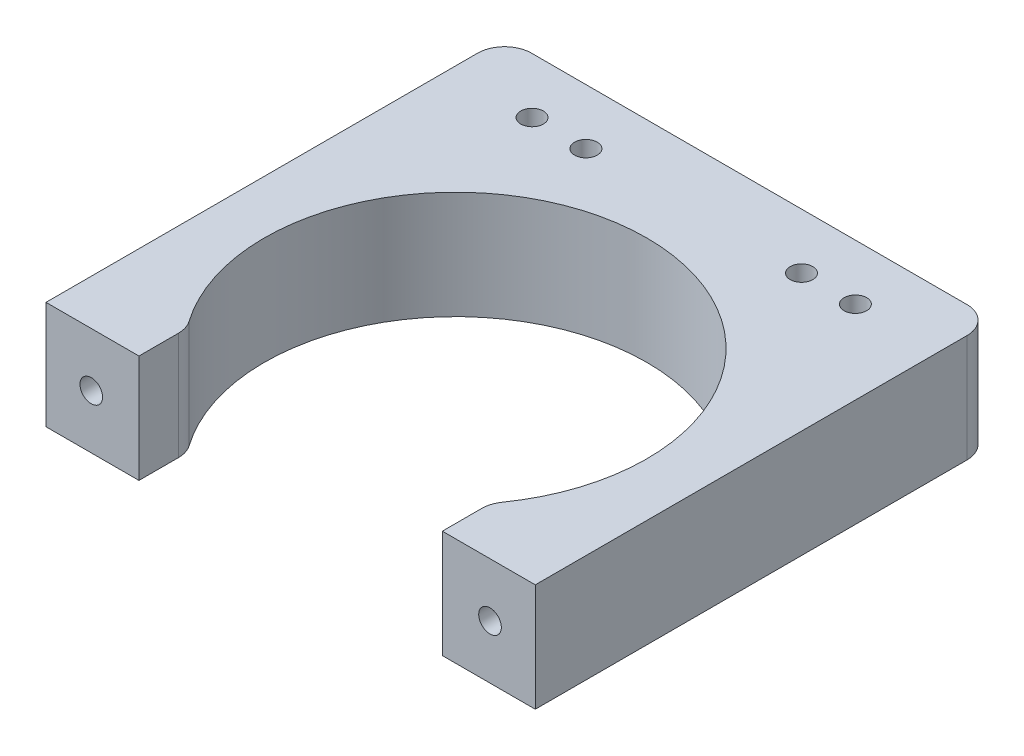
from build123d import *

# Parameters (mm, degrees)
BOSS_EXTRUDE1_DEPTH            = 20
SKETCH3_R                      = 2.1
CUT_EXTRUDE1_DEPTH             = 66.357956669
F_4_2_4_2_DIAMETER_HOLE1_D     = 4.2
F_4_2_4_2_DIAMETER_HOLE1_DEPTH = 6
F_4_2_4_2_DIAMETER_HOLE1_TIP   = 1.2618073
F_4_2_4_2_DIAMETER_HOLE4_D     = 4.2
F_4_2_4_2_DIAMETER_HOLE4_DEPTH = 6
F_4_2_4_2_DIAMETER_HOLE4_TIP   = 1.2618073
FILLET2_R                      = 5


with BuildPart() as part:
    # Sketch1 → Boss-Extrude1 (new body)
    with BuildSketch(Plane(origin=(0, 0, 0), x_dir=(1, 0, 0), z_dir=(0, 1, 0))):
        with BuildLine():
            Line((28.15, -42.55), (45.4, -42.55))
            Line((45.4, -42.55), (45.4, 42.55))
            Line((45.4, 42.55), (-45.4, 42.55))
            Line((-45.4, 42.55), (-45.4, -42.55))
            Line((-45.4, -42.55), (-28.15, -42.55))
            Line((-28.15, -42.55), (-28.15, -33.579320378))
            ThreePointArc((-28.15, -33.579320378), (0, 23.55), (28.15, -33.579320378))
            Line((28.15, -33.579320378), (28.15, -42.55))
        make_face()
    extrude(amount=BOSS_EXTRUDE1_DEPTH)

    # Sketch3 → Cut-Extrude1 (cut, through all)
    with BuildSketch(Plane(origin=(0, 20, 0), x_dir=(1, 0, 0), z_dir=(0, 1, 0))):
        with Locations(Location((-30, 32.25, 0), (0, 0, 270))):
            Circle(SKETCH3_R)
        with Locations(Location((-20, 32.25, 0), (0, 0, 270))):
            Circle(SKETCH3_R)
        with Locations(Location((20, 32.25, 0), (0, 0, 90))):
            Circle(SKETCH3_R)
        with Locations(Location((30, 32.25, 0), (0, 0, 90))):
            Circle(SKETCH3_R)
    extrude(amount=-CUT_EXTRUDE1_DEPTH, mode=Mode.SUBTRACT)

    # Ø4.2 (4.2) Diameter Hole1
    with Locations(Plane(origin=(0, 0, -42.55), x_dir=(-1, 0, 0), z_dir=(0, 0, -1))):
        with Locations((-30, 10), (-10, 10), (10, 10), (30, 10)):
            Hole(F_4_2_4_2_DIAMETER_HOLE1_D / 2, depth=F_4_2_4_2_DIAMETER_HOLE1_DEPTH)
            with Locations((0, 0, -(F_4_2_4_2_DIAMETER_HOLE1_DEPTH + F_4_2_4_2_DIAMETER_HOLE1_TIP / 2))):  # 118° drill point
                Cone(0, F_4_2_4_2_DIAMETER_HOLE1_D / 2, F_4_2_4_2_DIAMETER_HOLE1_TIP, mode=Mode.SUBTRACT)

    # Ø4.2 (4.2) Diameter Hole4
    with Locations(Plane.ZY.offset(45.4)):
        with Locations((-17.45, 10), (22.55, 10)):
            Hole(F_4_2_4_2_DIAMETER_HOLE4_D / 2, depth=F_4_2_4_2_DIAMETER_HOLE4_DEPTH)
            with Locations((0, 0, -(F_4_2_4_2_DIAMETER_HOLE4_DEPTH + F_4_2_4_2_DIAMETER_HOLE4_TIP / 2))):  # 118° drill point
                Cone(0, F_4_2_4_2_DIAMETER_HOLE4_D / 2, F_4_2_4_2_DIAMETER_HOLE4_TIP, mode=Mode.SUBTRACT)

    # Sketch20 → Ø4.2 (4.2) Diameter Hole6 (revolve, cut)
    with BuildSketch(Plane(origin=(-37, 10, 42.55), x_dir=(0, -1, 0), z_dir=(1, 0, 0))):
        Polygon((0, 0), (0, 7.2618073), (2.1, 6), (2.1, 0), align=None)
    f_4_2_4_2_diameter_hole6 = revolve(axis=Axis((-37, 10, 48.9), (0, 0, -1)), mode=Mode.SUBTRACT)

    # Mirror2: Ø4.2 (4.2) Diameter Hole6 across plane
    add(f_4_2_4_2_diameter_hole6.mirror(Plane(origin=(0, 0, 0), x_dir=(0, 0, 1), z_dir=(1, 0, 0))), mode=Mode.SUBTRACT)

    # Fillet2
    fillet2_edges = [part.edges().sort_by_distance(p)[0] for p in [
        (28.15, 10, 33.579320378),
        (-28.15, 10, 33.579320378),
        (-45.4, 10, -42.55),
        (45.4, 10, -42.55),
    ]]
    fillet(fillet2_edges, radius=FILLET2_R)


solid = part.part
